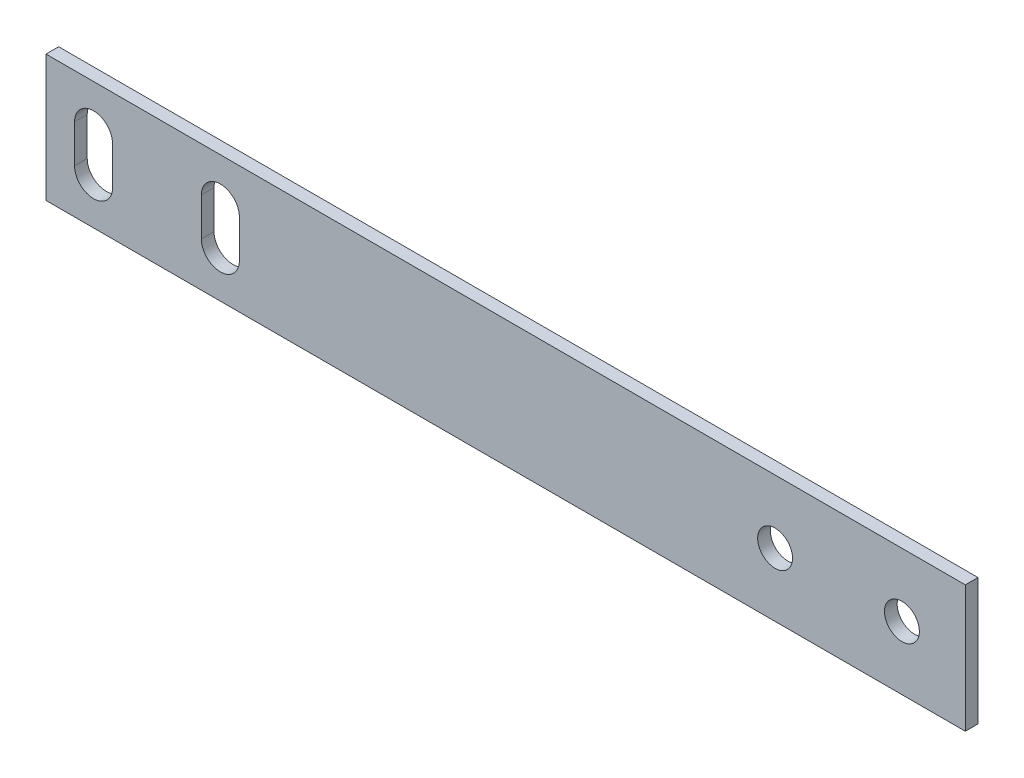
from build123d import *

# Parameters (mm, degrees)
SKETCH1_W           = 145
SKETCH1_H           = 20
SKETCH1_R           = 2.75
BOSS_EXTRUDE1_DEPTH = 2


with BuildPart() as part:
    # Sketch1 → Boss-Extrude1 (new body)
    with BuildSketch(Plane.XY):
        Rectangle(SKETCH1_W, SKETCH1_H)
        with Locations((62.5, 0)):
            Circle(SKETCH1_R, mode=Mode.SUBTRACT)
        with Locations((42.5, 0)):
            Circle(SKETCH1_R, mode=Mode.SUBTRACT)
        with BuildLine():
            Line((-68, -3), (-68, 3))
            ThreePointArc((-68, 3), (-65, 6), (-62, 3))
            Line((-62, 3), (-62, -3))
            ThreePointArc((-62, -3), (-65, -6), (-68, -3))
        make_face(mode=Mode.SUBTRACT)
        with BuildLine():
            Line((-48, -3), (-48, 3))
            ThreePointArc((-48, 3), (-45, 6), (-42, 3))
            Line((-42, 3), (-42, -3))
            ThreePointArc((-42, -3), (-45, -6), (-48, -3))
        make_face(mode=Mode.SUBTRACT)
    extrude(amount=BOSS_EXTRUDE1_DEPTH)


solid = part.part
